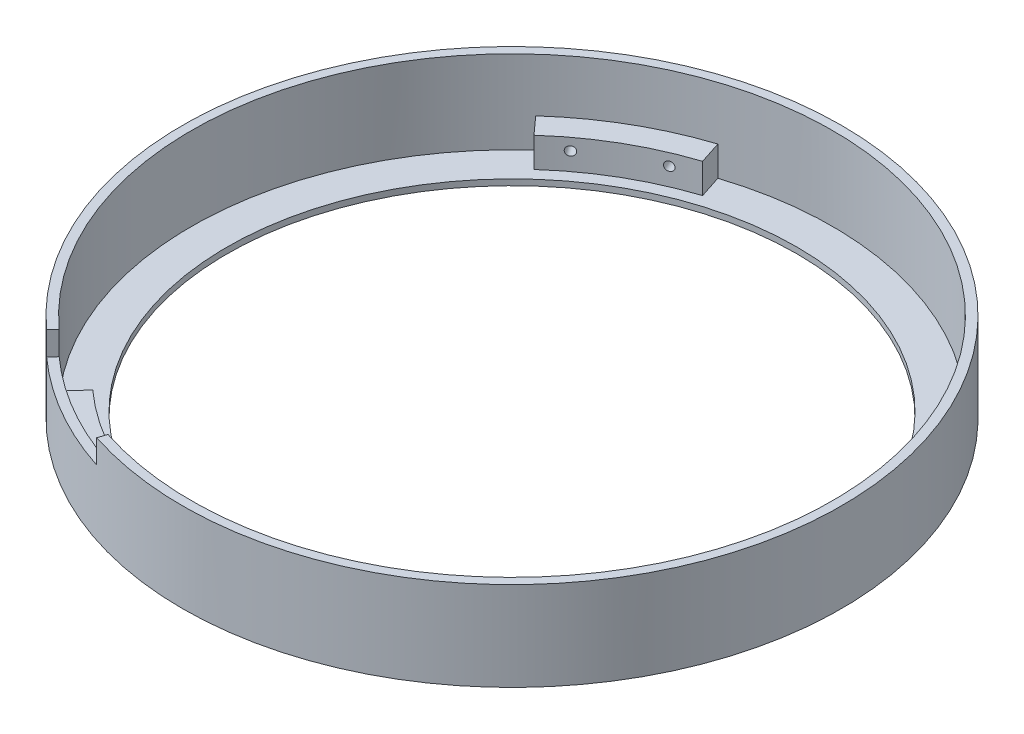
from build123d import *

# Parameters (mm, degrees)
BOSS_EXTRUDE1_DEPTH                 = 5
BOSS_EXTRUDE2_DEPTH                 = 5
BOSS_EXTRUDE3_DEPTH                 = 5
F_1_5MM_DOWEL_HOLE1_D               = 1.5
F_1_5MM_DOWEL_HOLE1_DEPTH           = 3
F_1_5MM_DOWEL_HOLE1_TIP             = 0.450645464
F_1_5MM_DOWEL_HOLE1_ON_FACE_2_D     = 1.5
F_1_5MM_DOWEL_HOLE1_ON_FACE_2_DEPTH = 3
F_1_5MM_DOWEL_HOLE1_ON_FACE_2_TIP   = 0.450645464
F_1_5MM_DOWEL_HOLE1_ON_FACE_3_D     = 1.5
F_1_5MM_DOWEL_HOLE1_ON_FACE_3_DEPTH = 3
F_1_5MM_DOWEL_HOLE1_ON_FACE_3_TIP   = 0.450645464
F_1_5MM_DOWEL_HOLE1_ON_FACE_4_D     = 1.5
F_1_5MM_DOWEL_HOLE1_ON_FACE_4_DEPTH = 3
F_1_5MM_DOWEL_HOLE1_ON_FACE_4_TIP   = 0.450645464
F_1_5MM_DOWEL_HOLE1_ON_FACE_5_D     = 1.5
F_1_5MM_DOWEL_HOLE1_ON_FACE_5_DEPTH = 3
F_1_5MM_DOWEL_HOLE1_ON_FACE_5_TIP   = 0.450645464
F_1_5MM_DOWEL_HOLE1_ON_FACE_6_D     = 1.5
F_1_5MM_DOWEL_HOLE1_ON_FACE_6_DEPTH = 3
F_1_5MM_DOWEL_HOLE1_ON_FACE_6_TIP   = 0.450645464
CUT_EXTRUDE2_DEPTH                  = 4


with BuildPart() as part:
    # Sketch1 → Revolve1 (revolve)
    with BuildSketch(Plane.XY):
        Polygon((55.5, -4), (55.5, 11), (54, 11), (54, -3), (48, -3), (48, -4), align=None)
    revolve(axis=Axis((0, 0, 0), (0, 1, 0)))

    # Sketch3 → Boss-Extrude1 (add)
    with BuildSketch(Plane(origin=(0, -3, 0), x_dir=(1, 0, 0), z_dir=(0, 1, 0))):
        with BuildLine():
            Line((-16.686917696, -51.35705188), (-15.450849719, -47.552825815))
            ThreePointArc((-15.450849719, -47.552825815), (-25, -43.301270189), (-33.456530318, -37.157241274))
            Line((-33.456530318, -37.157241274), (-36.133052743, -40.129820576))
            ThreePointArc((-36.133052743, -40.129820576), (-27, -46.765371804), (-16.686917696, -51.35705188))
        make_face()
    extrude(amount=BOSS_EXTRUDE1_DEPTH)

    # Sketch3<3> → Boss-Extrude2 (add)
    with BuildSketch(Plane(origin=(0, -3, 0), x_dir=(1, 0, 0), z_dir=(0, 1, 0))):
        with BuildLine():
            ThreePointArc((48.907380037, 10.395584541), (49.726094768, 5.226423163), (50, 0))
            ThreePointArc((50, 0), (49.726094768, -5.226423163), (48.907380037, -10.395584541))
            Line((48.907380037, -10.395584541), (52.81997044, -11.227231304))
            ThreePointArc((52.81997044, -11.227231304), (53.70418235, -5.644537016), (54, 0))
            ThreePointArc((54, 0), (53.70418235, 5.644537016), (52.81997044, 11.227231304))
            Line((52.81997044, 11.227231304), (48.907380037, 10.395584541))
        make_face()
    extrude(amount=BOSS_EXTRUDE2_DEPTH)

    # Sketch3<4> → Boss-Extrude3 (add)
    with BuildSketch(Plane(origin=(0, -3, 0), x_dir=(1, 0, 0), z_dir=(0, 1, 0))):
        with BuildLine():
            Line((-36.133052743, 40.129820576), (-33.456530318, 37.157241274))
            ThreePointArc((-33.456530318, 37.157241274), (-25, 43.301270189), (-15.450849719, 47.552825815))
            Line((-15.450849719, 47.552825815), (-16.686917696, 51.35705188))
            ThreePointArc((-16.686917696, 51.35705188), (-27, 46.765371804), (-36.133052743, 40.129820576))
        make_face()
    extrude(amount=BOSS_EXTRUDE3_DEPTH)

    # Ø1.5mm Dowel Hole1
    with Locations(Plane(origin=(-30.090751158, 0, -39.931775502), x_dir=(0.798635510047, 0, -0.601815023152), z_dir=(0.601815023152, 0, 0.798635510047))):
        with Locations((1e-09, 0)):
            Hole(F_1_5MM_DOWEL_HOLE1_D / 2, depth=F_1_5MM_DOWEL_HOLE1_DEPTH)
            with Locations((0, 0, -(F_1_5MM_DOWEL_HOLE1_DEPTH + F_1_5MM_DOWEL_HOLE1_TIP / 2))):  # 118° drill point
                Cone(0, F_1_5MM_DOWEL_HOLE1_D / 2, F_1_5MM_DOWEL_HOLE1_TIP, mode=Mode.SUBTRACT)

    # Ø1.5mm Dowel Hole1 on face 2
    with Locations(Plane(origin=(-19.536556424, 0, -46.025242673), x_dir=(0.92050492204, 0, -0.390730966908), z_dir=(0.390730966908, 0, 0.92050492204))):
        with Locations((-1e-09, 0)):
            Hole(F_1_5MM_DOWEL_HOLE1_ON_FACE_2_D / 2, depth=F_1_5MM_DOWEL_HOLE1_ON_FACE_2_DEPTH)
            with Locations((0, 0, -(F_1_5MM_DOWEL_HOLE1_ON_FACE_2_DEPTH + F_1_5MM_DOWEL_HOLE1_ON_FACE_2_TIP / 2))):  # 118° drill point
                Cone(0, F_1_5MM_DOWEL_HOLE1_ON_FACE_2_D / 2, F_1_5MM_DOWEL_HOLE1_ON_FACE_2_TIP, mode=Mode.SUBTRACT)

    # Ø1.5mm Dowel Hole1 on face 3
    with Locations(Plane(origin=(49.627307582, 0, -6.09346717), x_dir=(-0.121869023443, 0, -0.992546190928), z_dir=(-0.992546190928, 0, 0.121869023443))):
        with Locations((0, 0)):
            Hole(F_1_5MM_DOWEL_HOLE1_ON_FACE_3_D / 2, depth=F_1_5MM_DOWEL_HOLE1_ON_FACE_3_DEPTH)
            with Locations((0, 0, -(F_1_5MM_DOWEL_HOLE1_ON_FACE_3_DEPTH + F_1_5MM_DOWEL_HOLE1_ON_FACE_3_TIP / 2))):  # 118° drill point
                Cone(0, F_1_5MM_DOWEL_HOLE1_ON_FACE_3_D / 2, F_1_5MM_DOWEL_HOLE1_ON_FACE_3_TIP, mode=Mode.SUBTRACT)

    # Ø1.5mm Dowel Hole1 on face 4
    with Locations(Plane(origin=(49.627307582, 0, 6.09346717), x_dir=(0.121869023443, 0, -0.992546190928), z_dir=(-0.992546190928, 0, -0.121869023443))):
        with Locations((0, 0)):
            Hole(F_1_5MM_DOWEL_HOLE1_ON_FACE_4_D / 2, depth=F_1_5MM_DOWEL_HOLE1_ON_FACE_4_DEPTH)
            with Locations((0, 0, -(F_1_5MM_DOWEL_HOLE1_ON_FACE_4_DEPTH + F_1_5MM_DOWEL_HOLE1_ON_FACE_4_TIP / 2))):  # 118° drill point
                Cone(0, F_1_5MM_DOWEL_HOLE1_ON_FACE_4_D / 2, F_1_5MM_DOWEL_HOLE1_ON_FACE_4_TIP, mode=Mode.SUBTRACT)

    # Ø1.5mm Dowel Hole1 on face 5
    with Locations(Plane(origin=(-30.090751158, 0, 39.931775502), x_dir=(-0.798635698626, 0, -0.601814772899), z_dir=(0.601814772899, 0, -0.798635698626))):
        with Locations((-1e-09, 0)):
            Hole(F_1_5MM_DOWEL_HOLE1_ON_FACE_5_D / 2, depth=F_1_5MM_DOWEL_HOLE1_ON_FACE_5_DEPTH)
            with Locations((0, 0, -(F_1_5MM_DOWEL_HOLE1_ON_FACE_5_DEPTH + F_1_5MM_DOWEL_HOLE1_ON_FACE_5_TIP / 2))):  # 118° drill point
                Cone(0, F_1_5MM_DOWEL_HOLE1_ON_FACE_5_D / 2, F_1_5MM_DOWEL_HOLE1_ON_FACE_5_TIP, mode=Mode.SUBTRACT)

    # Ø1.5mm Dowel Hole1 on face 6
    with Locations(Plane(origin=(-19.536556424, 0, 46.025242673), x_dir=(-0.92050492204, 0, -0.390730966908), z_dir=(0.390730966908, 0, -0.92050492204))):
        with Locations((1e-09, 0)):
            Hole(F_1_5MM_DOWEL_HOLE1_ON_FACE_6_D / 2, depth=F_1_5MM_DOWEL_HOLE1_ON_FACE_6_DEPTH)
            with Locations((0, 0, -(F_1_5MM_DOWEL_HOLE1_ON_FACE_6_DEPTH + F_1_5MM_DOWEL_HOLE1_ON_FACE_6_TIP / 2))):  # 118° drill point
                Cone(0, F_1_5MM_DOWEL_HOLE1_ON_FACE_6_D / 2, F_1_5MM_DOWEL_HOLE1_ON_FACE_6_TIP, mode=Mode.SUBTRACT)

    # Sketch7 → Cut-Extrude2 (cut)
    with BuildSketch(Plane(origin=(0, 11, 0), x_dir=(1, 0, 0), z_dir=(0, 1, 0))):
        with BuildLine():
            Line((-17.150443188, -52.783636654), (-16.686917696, -51.35705188))
            ThreePointArc((-16.686917696, -51.35705188), (-27, -46.765371804), (-36.133052743, -40.129820576))
            Line((-36.133052743, -40.129820576), (-37.136748653, -41.244537814))
            ThreePointArc((-37.136748653, -41.244537814), (-27.75, -48.06440991), (-17.150443188, -52.783636654))
        make_face()
    extrude(amount=-CUT_EXTRUDE2_DEPTH, mode=Mode.SUBTRACT)


solid = part.part
